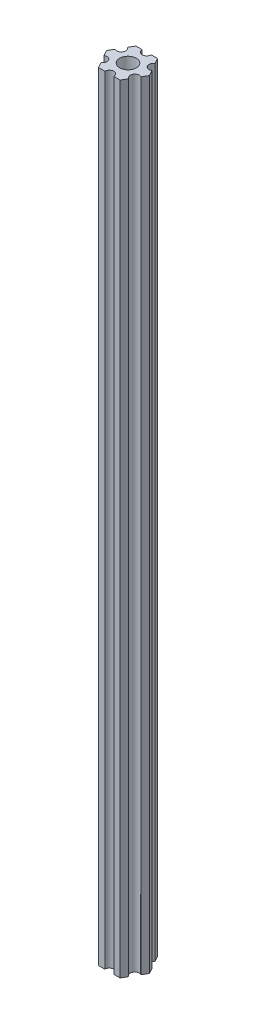
from build123d import *

# Parameters (mm, degrees)
ESBO_O1_R                = 2.79
RESSALTO_EXTRUS_O1_DEPTH = 260


with BuildPart() as part:
    # Esboço1 → Ressalto-extrusão1 (new body)
    with BuildSketch(Plane(origin=(0, 85, 0), x_dir=(1, 0, 0), z_dir=(0, 1, 0))):
        with BuildLine():
            Line((6.162658774, -1.825961894), (7.216878365, 0))
            Line((7.216878365, 0), (6.162658774, 1.825961894))
            ThreePointArc((6.162658774, 1.825961894), (4.113620668, 2.375), (4.662658774, 4.424038106))
            Line((4.662658774, 4.424038106), (3.608439182, 6.25))
            Line((3.608439182, 6.25), (1.5, 6.25))
            ThreePointArc((1.5, 6.25), (0, 4.75), (-1.5, 6.25))
            Line((-1.5, 6.25), (-3.608439182, 6.25))
            Line((-3.608439182, 6.25), (-4.662658774, 4.424038106))
            ThreePointArc((-4.662658774, 4.424038106), (-4.113620668, 2.375), (-6.162658774, 1.825961894))
            Line((-6.162658774, 1.825961894), (-7.216878365, 0))
            Line((-7.216878365, 0), (-6.162658774, -1.825961894))
            ThreePointArc((-6.162658774, -1.825961894), (-4.113620668, -2.375), (-4.662658774, -4.424038106))
            Line((-4.662658774, -4.424038106), (-3.608439182, -6.25))
            Line((-3.608439182, -6.25), (-1.5, -6.25))
            ThreePointArc((-1.5, -6.25), (0, -4.75), (1.5, -6.25))
            Line((1.5, -6.25), (3.608439182, -6.25))
            Line((3.608439182, -6.25), (4.662658774, -4.424038106))
            ThreePointArc((4.662658774, -4.424038106), (4.113620668, -2.375), (6.162658774, -1.825961894))
        make_face()
        with Locations(Location((0, 0, 0), (0, 0, 90))):
            Circle(ESBO_O1_R, mode=Mode.SUBTRACT)
    extrude(amount=-RESSALTO_EXTRUS_O1_DEPTH)


solid = part.part
